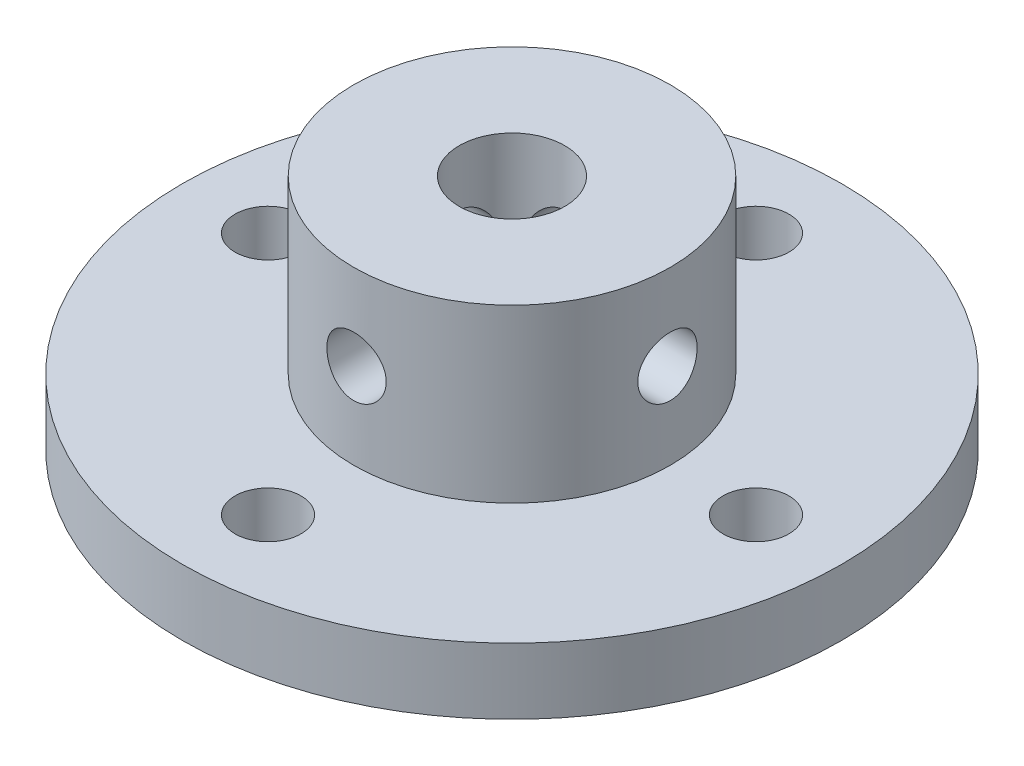
from build123d import *

# Parameters (mm, degrees)
SKETCH_1_R               = 25
EXTRUDE_1_DEPTH          = 5
SKETCH_2_R               = 12
EXTRUDE_2_DEPTH          = 13
SKETCH_3_R               = 4
CUT_EXTRUDE_1_DEPTH      = 40.67366885
SKETCH_4_R               = 2.5
CUT_EXTRUDE_2_DEPTH      = 38.669616404
CUT_EXTRUDE_3_DEPTH      = 40.67366885
CUT_EXTRUDE_3_DEPTH_BACK = 40.67366885
SKETCH_5_R               = 2.25
CUT_EXTRUDE_4_DEPTH      = 40.673668895
CUT_EXTRUDE_4_DEPTH_BACK = 40.673668895
SKETCH_6_R               = 2.25


with BuildPart() as part:
    # 草图1 → 凸台-拉伸1 (new body)
    with BuildSketch(Plane(origin=(0, 0, 0), x_dir=(1, 0, 0), z_dir=(0, 1, 0))):
        with Locations(Location((0, 0, 0), (0, 0, 270))):
            Circle(SKETCH_1_R)
    extrude(amount=EXTRUDE_1_DEPTH)

    # 草图2 → 凸台-拉伸2 (add)
    with BuildSketch(Plane(origin=(0, 5, 0), x_dir=(1, 0, 0), z_dir=(0, 1, 0))):
        with Locations(Location((0, 0, 0), (0, 0, 90))):
            Circle(SKETCH_2_R)
    extrude(amount=EXTRUDE_2_DEPTH)

    # 草图3 → 切除-拉伸1 (cut, through all)
    with BuildSketch(Plane(origin=(0, 18, 0), x_dir=(1, 0, 0), z_dir=(0, 1, 0))):
        with Locations(Location((0, 0, 0), (0, 0, 270))):
            Circle(SKETCH_3_R)
    extrude(amount=-CUT_EXTRUDE_1_DEPTH, mode=Mode.SUBTRACT)

    # 草图4 → 切除-拉伸2 (cut, through all)
    with BuildSketch(Plane(origin=(0, 5, 0), x_dir=(1, 0, 0), z_dir=(0, 1, 0))):
        with Locations(Location((0, 18.5, 0), (0, 0, 270))):
            Circle(SKETCH_4_R)
        with Locations(Location((18.5, 0, 0), (0, 0, 270))):
            Circle(SKETCH_4_R)
        with Locations(Location((0, -18.5, 0), (0, 0, 270))):
            Circle(SKETCH_4_R)
        with Locations(Location((-18.5, 0, 0), (0, 0, 270))):
            Circle(SKETCH_4_R)
    extrude(amount=-CUT_EXTRUDE_2_DEPTH, mode=Mode.SUBTRACT)

    # 草图5 → 切除-拉伸3 (cut, two sides: drawn at the far end of the back side and taken through both)
    with BuildSketch(Plane(origin=(0, 0, 0), x_dir=(0, 0, -1), z_dir=(1, 0, 0)).offset(-CUT_EXTRUDE_3_DEPTH_BACK)):
        with Locations((0, 11.5)):
            Circle(SKETCH_5_R)
    extrude(amount=CUT_EXTRUDE_3_DEPTH + CUT_EXTRUDE_3_DEPTH_BACK, mode=Mode.SUBTRACT)

    # 草图6 → 切除-拉伸4 (cut, two sides: drawn at the far end of the back side and taken through both)
    with BuildSketch(Plane.XY.offset(-CUT_EXTRUDE_4_DEPTH_BACK)):
        with Locations((0, 11.5)):
            Circle(SKETCH_6_R)
    extrude(amount=CUT_EXTRUDE_4_DEPTH + CUT_EXTRUDE_4_DEPTH_BACK, mode=Mode.SUBTRACT)


solid = part.part
